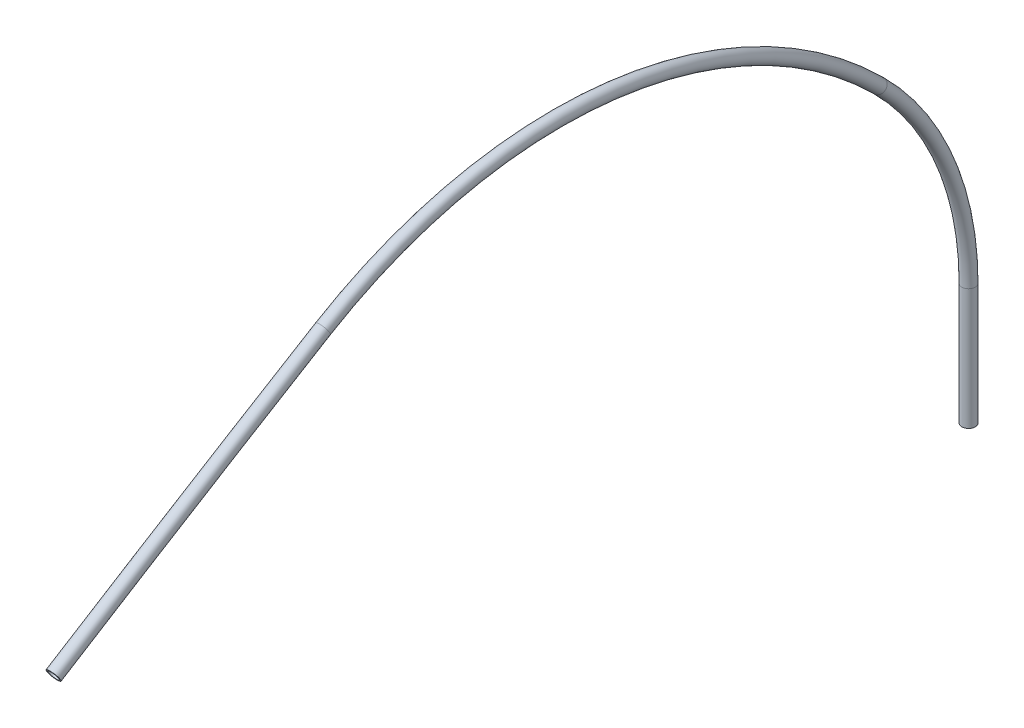
from build123d import *

# Parameters (mm, degrees)
CROQUIS7_R = 5
VACIADO2_T = -1


with BuildPart() as part:
    # Barrer1: sweep along a path in Croquis5
    with BuildLine(Plane(origin=(0, 0, 0), x_dir=(0, 0, -1), z_dir=(1, 0, 0))) as barrer1_path:
        Line((-12, 40), (-12, 130.560717654))
        ThreePointArc((-12, 130.560717654), (-29.437368549, 218.035724085), (-79.083773346, 292.13817386))
        ThreePointArc((-79.083773346, 292.13817386), (-278.39944529, 388.989249667), (-495.10676135, 342.677187166))
        ThreePointArc((-495.10676135, 342.677187166), (-596.219459237, 281.176799347), (-696.776704972, 218.772346732))
    # Croquis7 → Barrer1 (sweep)
    with BuildSketch(Plane(origin=(0, 40, 12), x_dir=(-1, 0, 0), z_dir=(0, 1, 0))):
        Circle(CROQUIS7_R)
    sweep(path=barrer1_path.line)

    # Vaciado2
    vaciado2_openings = [part.faces().sort_by_distance(p)[0] for p in [
        (0, 218.772346732, 696.776704972),
        (0, 40, 12),
    ]]
    offset(amount=VACIADO2_T, openings=vaciado2_openings, kind=Kind.INTERSECTION)


solid = part.part
